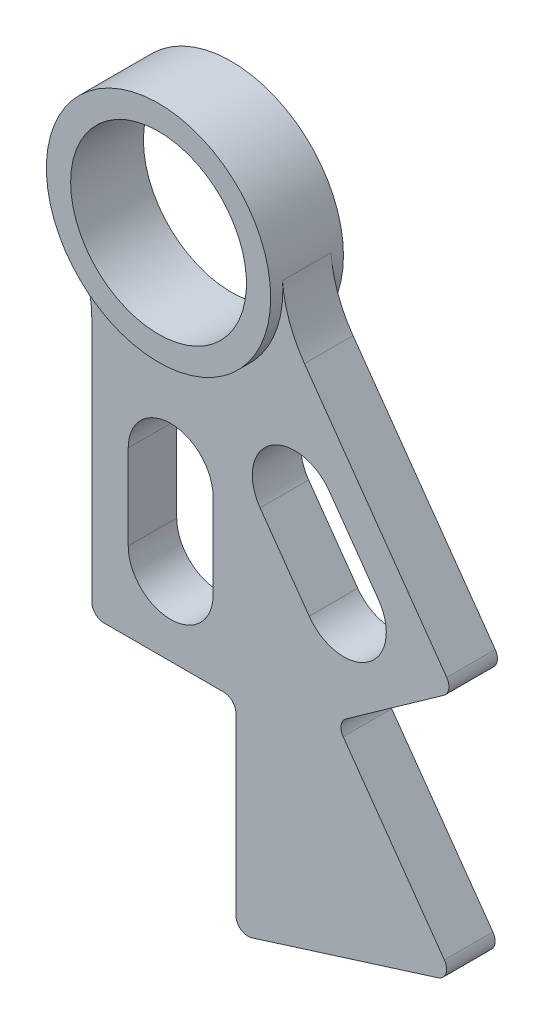
from build123d import *

# Parameters (mm, degrees)
SKETCH1_R           = 11.5062
BOSS_EXTRUDE1_DEPTH = 4.7625
BOSS_EXTRUDE2_DEPTH = 3.175
FILLET2_R           = 1.5875


with BuildPart() as part:
    # Sketch1 → Boss-Extrude1 (new, symmetric)
    with BuildSketch(Plane.XY):
        with BuildLine():
            ThreePointArc((14.639156809, 1.110279863), (-4.45502565, 13.988937769), (-12.585193267, -7.559797873))
            ThreePointArc((-12.585193267, -7.559797873), (4.45502565, -13.988937769), (14.639156809, 1.110279863))
        make_face()
        with Locations(Location((0, 0, 0), (0, 0, 180))):
            Circle(SKETCH1_R, mode=Mode.SUBTRACT)
    extrude(amount=BOSS_EXTRUDE1_DEPTH, both=True)

    # Sketch5 → Boss-Extrude2 (add, symmetric)
    with BuildSketch(Plane.XY):
        with BuildLine():
            ThreePointArc((-12.585193267, -7.559797873), (-10.89585042, -11.492870345), (-10.31875, -15.734319794))
            Line((-10.31875, -15.734319794), (-10.31875, -49.389319794))
            Line((-10.31875, -49.389319794), (8.54075, -49.389319794))
            Line((8.54075, -49.389319794), (8.54075, -76.059319794))
            Line((8.54075, -76.059319794), (37.089554297, -67.094446092))
            Line((37.089554297, -67.094446092), (21.666696712, -45.336128971))
            Line((21.666696712, -45.336128971), (37.052935248, -34.429965394))
            Line((37.052935248, -34.429965394), (17.517315641, -6.869430374))
            ThreePointArc((17.517315641, -6.869430374), (15.535368252, -3.075379389), (14.639156809, 1.110279863))
            ThreePointArc((14.639156809, 1.110279863), (4.45502565, -13.988937769), (-12.585193267, -7.559797873))
        make_face()
        with BuildLine():
            ThreePointArc((5.55625, -39.070569794), (0, -44.626819794), (-5.55625, -39.070569794))
            Line((-5.55625, -39.070569794), (-5.55625, -27.958069794))
            ThreePointArc((-5.55625, -27.958069794), (0, -22.401819794), (5.55625, -27.958069794))
            Line((5.55625, -27.958069794), (5.55625, -39.070569794))
        make_face(mode=Mode.SUBTRACT)
        with BuildLine():
            ThreePointArc((27.200344435, -28.7656506), (25.880457031, -36.511728663), (18.134378968, -35.19184126))
            Line((18.134378968, -35.19184126), (11.708188308, -26.125875793))
            ThreePointArc((11.708188308, -26.125875793), (13.028075711, -18.379797729), (20.774153775, -19.699685133))
            Line((20.774153775, -19.699685133), (27.200344435, -28.7656506))
        make_face(mode=Mode.SUBTRACT)
    extrude(amount=BOSS_EXTRUDE2_DEPTH, both=True)

    # Fillet2
    fillet2_edges = [part.edges().sort_by_distance(p)[0] for p in [
        (37.089554297, -67.094446092, 0),
        (21.666696712, -45.336128971, 0),
        (37.052935248, -34.429965394, 0),
        (-10.31875, -49.389319794, 0),
        (8.54075, -49.389319794, 0),
        (8.54075, -76.059319794, 0),
    ]]
    fillet(fillet2_edges, radius=FILLET2_R)


solid = part.part
